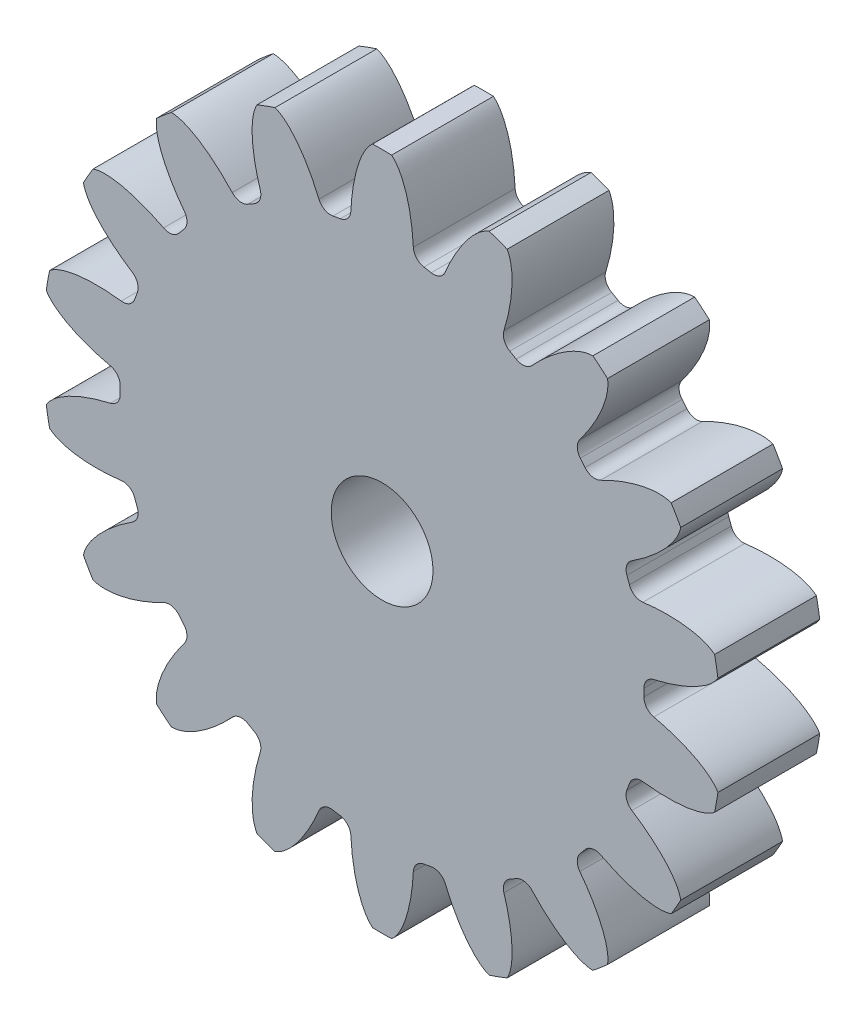
from build123d import *

# Parameters (mm, degrees)
SKETCH1_R                = 1.286
SKETCH1_R_2              = 0.25
BOSS_EXTRUDE1_DEPTH      = 0.5
BOSS_EXTRUDE2_DEPTH      = 0.5
FILLET4_R                = 0.062
CIRPATTERN8_COUNT        = 18
FILLET4_OF_CIRPATTERN8_R = 0.062


with BuildPart() as part:
    # Sketch1 → Boss-Extrude1 (new body)
    with BuildSketch(Plane.XY):
        Circle(SKETCH1_R)
        Circle(SKETCH1_R_2, mode=Mode.SUBTRACT)
    extrude(amount=BOSS_EXTRUDE1_DEPTH)

    # Sketch3 → Boss-Extrude2 (add)
    with BuildSketch(Plane.XY):
        with BuildLine():
            ThreePointArc((0.047, 1.666337301), (0, 1.667), (-0.047, 1.666337301))
            add(Edge.make_bspline(
                [(-0.047, 1.666337301), (-0.154592722, 1.575489952), (-0.154592722, 1.27667423)],
                knots=[3.450507114, 3.450507114, 3.450507114, 4.71238898, 4.71238898, 4.71238898], degree=2, weights=[1, 0.807472805, 1]))
            ThreePointArc((-0.154592722, 1.27667423), (0, 1.286), (0.154592722, 1.27667423))
            add(Edge.make_bspline(
                [(0.154592722, 1.27667423), (0.154592722, 1.575489952), (0.047, 1.666337301)],
                knots=[1.570796327, 1.570796327, 1.570796327, 2.832678193, 2.832678193, 2.832678193], degree=2, weights=[1, 0.807472805, 1]))
        make_face()
    boss_extrude2 = extrude(amount=BOSS_EXTRUDE2_DEPTH)

    # Fillet4
    fillet4_edges = [part.edges().sort_by_distance(p)[0] for p in [
        (0.154592722, 1.27667423, 0.25),
        (-0.154592722, 1.27667423, 0.25),
    ]]
    fillet(fillet4_edges, radius=FILLET4_R)

    # CirPattern8: Boss-Extrude2 ×18 about axis
    cirpattern8_axis = Axis((0, 0, 0.5), (0, 0, 1))
    for i in range(1, CIRPATTERN8_COUNT):
        add(boss_extrude2.rotate(cirpattern8_axis, i * 360 / CIRPATTERN8_COUNT))

    # Fillet4 of CirPattern8
    fillet4_of_cirpattern8_edges = [part.edges().sort_by_distance(p)[0] for p in [
        (-0.291378663, 1.252555178, 0.25),
        (-0.581917944, 1.146807528, 0.25),
        (-0.702205481, 1.077359486, 0.25),
        (-0.939055273, 0.878618913, 0.25),
        (-1.028335955, 0.77221834, 0.25),
        (-1.182928677, 0.50445589, 0.25),
        (-1.230433936, 0.373936265, 0.25),
        (-1.284123425, 0.069448042, 0.25),
        (-1.284123425, -0.069448042, 0.25),
        (-1.230433936, -0.373936265, 0.25),
        (-1.182928677, -0.50445589, 0.25),
        (-1.028335955, -0.77221834, 0.25),
        (-0.939055273, -0.878618913, 0.25),
        (-0.702205481, -1.077359486, 0.25),
        (-0.581917944, -1.146807528, 0.25),
        (-0.291378663, -1.252555178, 0.25),
        (-0.154592722, -1.27667423, 0.25),
        (0.154592722, -1.27667423, 0.25),
        (0.291378663, -1.252555178, 0.25),
        (0.581917944, -1.146807528, 0.25),
        (0.702205481, -1.077359486, 0.25),
        (0.939055273, -0.878618913, 0.25),
        (1.028335955, -0.77221834, 0.25),
        (1.182928677, -0.50445589, 0.25),
        (1.230433936, -0.373936265, 0.25),
        (1.284123425, -0.069448042, 0.25),
        (1.284123425, 0.069448042, 0.25),
        (1.230433936, 0.373936265, 0.25),
        (1.182928677, 0.50445589, 0.25),
        (1.028335955, 0.77221834, 0.25),
        (0.939055273, 0.878618913, 0.25),
        (0.702205481, 1.077359486, 0.25),
        (0.581917944, 1.146807528, 0.25),
        (0.291378663, 1.252555178, 0.25),
    ]]
    fillet(fillet4_of_cirpattern8_edges, radius=FILLET4_OF_CIRPATTERN8_R)


solid = part.part
